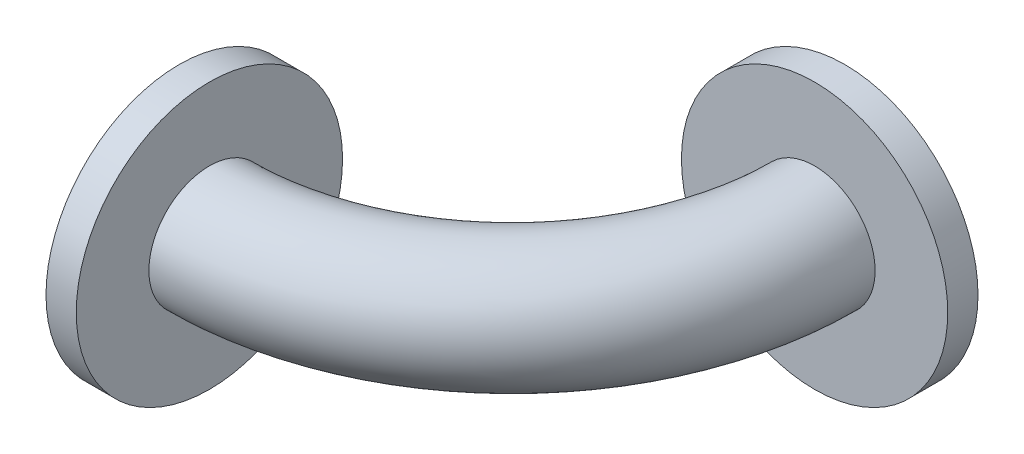
from build123d import *

# Parameters (mm, degrees)
SWEEP_2_PROFILE_R = 10
SKETCH_11_R       = 22
EXTRUDE_4_DEPTH   = 5
SKETCH_16_R       = 22
EXTRUDE_7_DEPTH   = 5


with BuildPart() as part:
    # 扫描2: sweep along a path in 草图1
    with BuildLine(Plane(origin=(0, 0, 0), x_dir=(1, 0, 0), z_dir=(0, 1, 0))) as sweep_2_path:
        ThreePointArc((50, 0), (35.3553, -35.3553), (0, -50))
    # 扫描2 profile (on start of the path) → 扫描2 (sweep)
    with BuildSketch(Plane(origin=(50, 0, 0), x_dir=(0.9999999999964432, 0, 2.6671391793895655e-06), z_dir=(-2.6671391793895655e-06, 0, 0.9999999999964432))):
        Circle(SWEEP_2_PROFILE_R)
    sweep(path=sweep_2_path.line)

    # 草图11 → 凸台-拉伸4 (add)
    with BuildSketch(Plane.XY):
        with Locations((50, 0)):
            Circle(SKETCH_11_R)
    extrude(amount=-EXTRUDE_4_DEPTH)

    # 草图16 → 凸台-拉伸7 (add)
    with BuildSketch(Plane(origin=(0, 0, 0), x_dir=(0, 0, -1), z_dir=(1, 0, 0))):
        with Locations((-50, 0)):
            Circle(SKETCH_16_R)
    extrude(amount=-EXTRUDE_7_DEPTH)


solid = part.part
